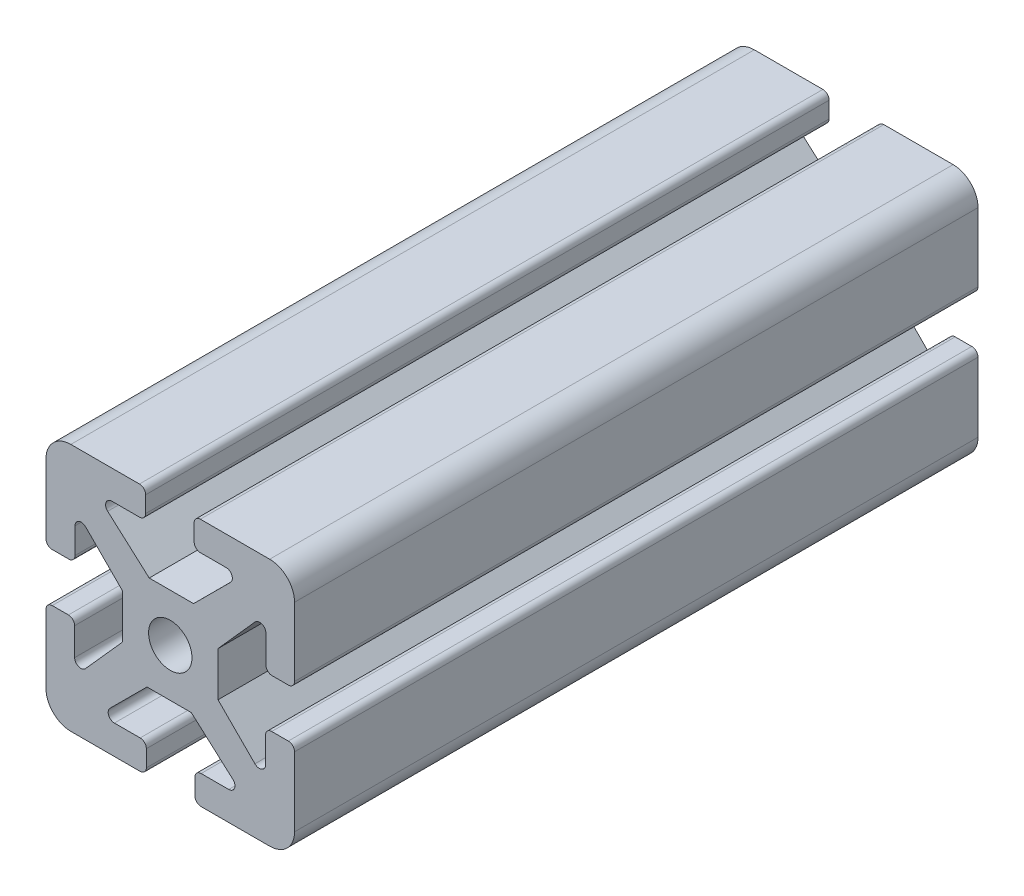
from build123d import *

# Parameters (mm, degrees)
SKETCH2_R           = 3.492543695
BOSS_EXTRUDE1_DEPTH = 110


with BuildPart() as part:
    # Sketch2 → Boss-Extrude1 (new body)
    with BuildSketch(Plane.XY):
        with BuildLine():
            Line((19.48831917, 27.684671829), (23.749889801, 27.684671829))
            Line((23.749889801, 27.684671829), (29.699681879, 33.624984685))
            ThreePointArc((29.699681879, 33.624984685), (29.917171057, 34.714970099), (28.993139054, 35.332654972))
            Line((28.993139054, 35.332654972), (24.845630957, 35.332654972))
            ThreePointArc((24.845630957, 35.332654972), (24.138524175, 35.625548191), (23.845630957, 36.332654972))
            Line((23.845630957, 36.332654972), (23.845630957, 39))
            ThreePointArc((23.845630957, 39), (24.138524175, 39.707106781), (24.845630957, 40))
            Line((24.845630957, 40), (36, 40))
            ThreePointArc((36, 40), (38.828427125, 38.828427125), (40, 36))
            Line((40, 36), (40, 24.961087436))
            ThreePointArc((40, 24.961087436), (39.707106781, 24.253980655), (39, 23.961087436))
            Line((39, 23.961087436), (36.388269628, 23.961087436))
            ThreePointArc((36.388269628, 23.961087436), (35.681162846, 24.253980655), (35.388269628, 24.961087436))
            Line((35.388269628, 24.961087436), (35.388269628, 29.408620307))
            ThreePointArc((35.388269628, 29.408620307), (34.744223919, 30.343123673), (33.641676542, 30.073901274))
            Line((33.641676542, 30.073901274), (27.684671829, 23.388818206))
            Line((27.684671829, 23.388818206), (27.684671829, 20.51168083))
            Line((27.684671829, 20.51168083), (27.684671829, 16.250110199))
            Line((27.684671829, 16.250110199), (33.624984685, 10.300318121))
            ThreePointArc((33.624984685, 10.300318121), (34.714970099, 10.082828943), (35.332654972, 11.006860946))
            Line((35.332654972, 11.006860946), (35.332654972, 15.154369043))
            ThreePointArc((35.332654972, 15.154369043), (35.625548191, 15.861475825), (36.332654972, 16.154369043))
            Line((36.332654972, 16.154369043), (39, 16.154369043))
            ThreePointArc((39, 16.154369043), (39.707106781, 15.861475825), (40, 15.154369043))
            Line((40, 15.154369043), (40, 4))
            ThreePointArc((40, 4), (38.828427125, 1.171572875), (36, 0))
            Line((36, 0), (24.961087436, 0))
            ThreePointArc((24.961087436, 0), (24.253980655, 0.292893219), (23.961087436, 1))
            Line((23.961087436, 1), (23.961087436, 3.611730372))
            ThreePointArc((23.961087436, 3.611730372), (24.253980655, 4.318837154), (24.961087436, 4.611730372))
            Line((24.961087436, 4.611730372), (29.408620307, 4.611730372))
            ThreePointArc((29.408620307, 4.611730372), (30.343123673, 5.255776081), (30.073901274, 6.358323458))
            Line((30.073901274, 6.358323458), (23.388818206, 12.315328171))
            Line((23.388818206, 12.315328171), (20.51168083, 12.315328171))
            Line((20.51168083, 12.315328171), (16.250110199, 12.315328171))
            Line((16.250110199, 12.315328171), (10.300318121, 6.375015315))
            ThreePointArc((10.300318121, 6.375015315), (10.082828943, 5.285029901), (11.006860946, 4.667345028))
            Line((11.006860946, 4.667345028), (15.154369043, 4.667345028))
            ThreePointArc((15.154369043, 4.667345028), (15.861475825, 4.374451809), (16.154369043, 3.667345028))
            Line((16.154369043, 3.667345028), (16.154369043, 1))
            ThreePointArc((16.154369043, 1), (15.861475825, 0.292893219), (15.154369043, 0))
            Line((15.154369043, 0), (4, 0))
            ThreePointArc((4, 0), (1.171572875, 1.171572875), (0, 4))
            Line((0, 4), (0, 15.038912564))
            ThreePointArc((0, 15.038912564), (0.292893219, 15.746019345), (1, 16.038912564))
            Line((1, 16.038912564), (3.611730372, 16.038912564))
            ThreePointArc((3.611730372, 16.038912564), (4.318837154, 15.746019345), (4.611730372, 15.038912564))
            Line((4.611730372, 15.038912564), (4.611730372, 10.591379693))
            ThreePointArc((4.611730372, 10.591379693), (5.255776081, 9.656876327), (6.358323458, 9.926098726))
            Line((6.358323458, 9.926098726), (12.315328171, 16.611181794))
            Line((12.315328171, 16.611181794), (12.315328171, 19.48831917))
            Line((12.315328171, 19.48831917), (12.315328171, 23.749889801))
            Line((12.315328171, 23.749889801), (6.375015315, 29.699681879))
            ThreePointArc((6.375015315, 29.699681879), (5.285029901, 29.917171057), (4.667345028, 28.993139054))
            Line((4.667345028, 28.993139054), (4.667345028, 24.845630957))
            ThreePointArc((4.667345028, 24.845630957), (4.374451809, 24.138524175), (3.667345028, 23.845630957))
            Line((3.667345028, 23.845630957), (1, 23.845630957))
            ThreePointArc((1, 23.845630957), (0.292893219, 24.138524175), (0, 24.845630957))
            Line((0, 24.845630957), (0, 36))
            ThreePointArc((0, 36), (1.171572875, 38.828427125), (4, 40))
            Line((4, 40), (15.038912564, 40))
            ThreePointArc((15.038912564, 40), (15.746019345, 39.707106781), (16.038912564, 39))
            Line((16.038912564, 39), (16.038912564, 36.388269628))
            ThreePointArc((16.038912564, 36.388269628), (15.746019345, 35.681162846), (15.038912564, 35.388269628))
            Line((15.038912564, 35.388269628), (10.591379693, 35.388269628))
            ThreePointArc((10.591379693, 35.388269628), (9.656876327, 34.744223919), (9.926098726, 33.641676542))
            Line((9.926098726, 33.641676542), (16.611181794, 27.684671829))
            Line((16.611181794, 27.684671829), (19.48831917, 27.684671829))
        make_face()
        with Locations((20, 20)):
            Circle(SKETCH2_R, mode=Mode.SUBTRACT)
    extrude(amount=BOSS_EXTRUDE1_DEPTH)


solid = part.part
